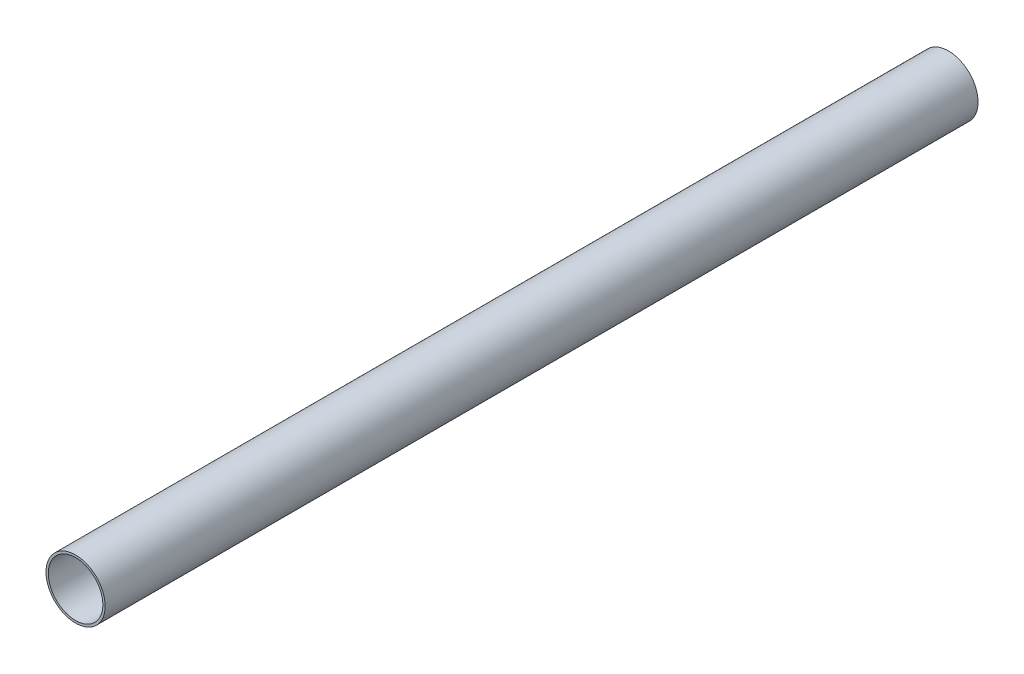
from build123d import *

# Parameters (mm, degrees)
CARDBOARD_MOTOR_TUBE_SKETCH_R   = 20.6375
CARDBOARD_MOTOR_TUBE_SKETCH_R_2 = 19.05
BOSS_EXTRUDE1_DEPTH             = 609.6


with BuildPart() as part:
    # Cardboard Motor Tube Sketch → Boss-Extrude1 (new body)
    with BuildSketch(Plane.XY):
        with Locations(Location((0, 0, 0), (0, 0, 180))):
            Circle(CARDBOARD_MOTOR_TUBE_SKETCH_R)
        with Locations(Location((0, 0, 0), (0, 0, 180))):
            Circle(CARDBOARD_MOTOR_TUBE_SKETCH_R_2, mode=Mode.SUBTRACT)
    extrude(amount=BOSS_EXTRUDE1_DEPTH)


solid = part.part
